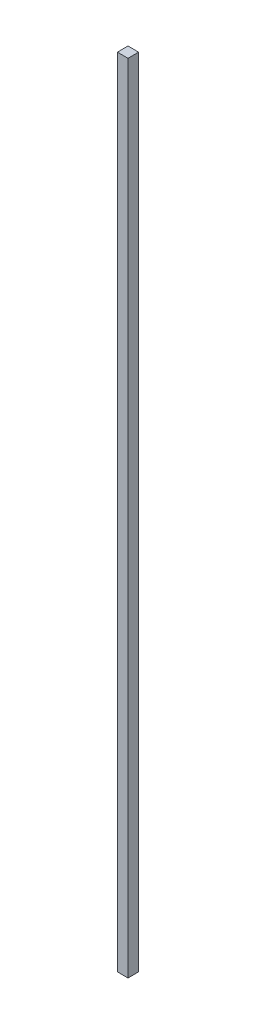
from build123d import *

# Parameters (mm, degrees)
SKETCH_1_W      = 40
SKETCH_1_H      = 40
EXTRUDE_1_DEPTH = 3000


with BuildPart() as part:
    # Эскиз1 → Бобышка-Вытянуть1 (new body)
    with BuildSketch(Plane(origin=(0, 0, 0), x_dir=(1, 0, 0), z_dir=(0, 1, 0))):
        with Locations((3.921182266, 3.272842841)):
            Rectangle(SKETCH_1_W, SKETCH_1_H)
    extrude(amount=EXTRUDE_1_DEPTH)


solid = part.part
